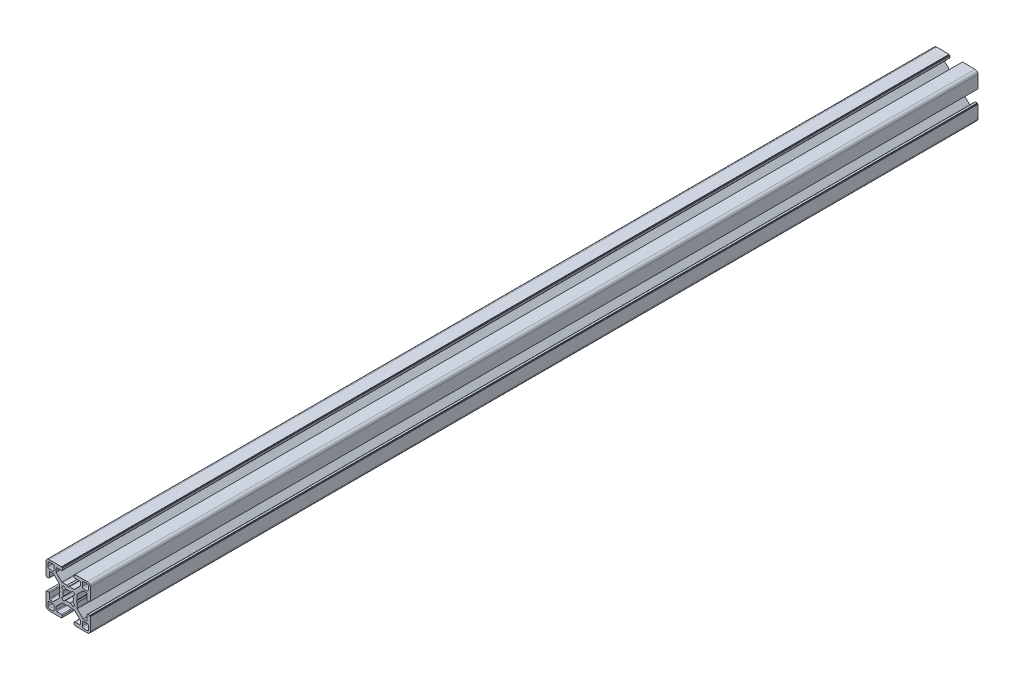
from build123d import *

# Parameters (mm, degrees)
BOSS_EXTRUDE1_DEPTH = 300
CIRPATTERN1_COUNT   = 4


with BuildPart() as part:
    # Sketch3 → Boss-Extrude1 (new, symmetric)
    with BuildSketch(Plane.XY):
        with BuildLine():
            Line((-4.503841895, 3.156803476), (-3.14772708, 1.530298739))
            ThreePointArc((-3.14772708, 1.530298739), (-3.410794979, 0.785160882), (-3.5, 0))
            Line((-3.5, 0), (-5.5, 0))
            Line((-5.5, 0), (-6, 0.866025404))
            Line((-6, 0.866025404), (-6, 3.996841995))
            ThreePointArc((-6, 3.996841995), (-6.038060234, 4.188183711), (-6.146446609, 4.350395385))
            Line((-6.146446609, 4.350395385), (-9.917104615, 8.121053391))
            ThreePointArc((-9.917104615, 8.121053391), (-10.079316289, 8.229439766), (-10.270658005, 8.2675))
            Line((-10.270658005, 8.2675), (-12.29, 8.2675))
            ThreePointArc((-12.29, 8.2675), (-12.643553391, 8.121053391), (-12.79, 7.7675))
            Line((-12.79, 7.7675), (-12.79, 4.5))
            ThreePointArc((-12.79, 4.5), (-12.936446609, 4.146446609), (-13.29, 4))
            Line((-13.29, 4), (-14.5, 4))
            Line((-14.5, 4), (-14.5, 4.5))
            Line((-14.5, 4.5), (-15, 4.5))
            Line((-15, 4.5), (-15, 12.968))
            ThreePointArc((-15, 12.968), (-14.404840979, 14.404840979), (-12.968, 15))
            Line((-12.968, 15), (-4.5, 15))
            Line((-4.5, 15), (-4.5, 14.5))
            Line((-4.5, 14.5), (-4, 14.5))
            Line((-4, 14.5), (-4, 13.29))
            ThreePointArc((-4, 13.29), (-4.146446609, 12.936446609), (-4.5, 12.79))
            Line((-4.5, 12.79), (-7.7675, 12.79))
            ThreePointArc((-7.7675, 12.79), (-8.121053391, 12.643553391), (-8.2675, 12.29))
            Line((-8.2675, 12.29), (-8.2675, 10.270658005))
            ThreePointArc((-8.2675, 10.270658005), (-8.229439766, 10.079316289), (-8.121053391, 9.917104615))
            Line((-8.121053391, 9.917104615), (-4.350395385, 6.146446609))
            ThreePointArc((-4.350395385, 6.146446609), (-4.188183711, 6.038060234), (-3.996841995, 6))
            Line((-3.996841995, 6), (-0.866025404, 6))
            Line((-0.866025404, 6), (0, 5.5))
            Line((0, 5.5), (0, 3.5))
            ThreePointArc((0, 3.5), (-0.785160882, 3.410794979), (-1.530298739, 3.14772708))
            Line((-1.530298739, 3.14772708), (-3.156803476, 4.503841895))
            ThreePointArc((-3.156803476, 4.503841895), (-3.889087297, 3.889087297), (-4.503841895, 3.156803476))
        make_face()
        with BuildLine():
            Line((-12.705, 9.5135), (-10.5135, 9.5135))
            ThreePointArc((-10.5135, 9.5135), (-9.806393219, 9.806393219), (-9.5135, 10.5135))
            Line((-9.5135, 10.5135), (-9.5135, 12.705))
            ThreePointArc((-9.5135, 12.705), (-9.806393219, 13.412106781), (-10.5135, 13.705))
            Line((-10.5135, 13.705), (-12.705, 13.705))
            ThreePointArc((-12.705, 13.705), (-13.412106781, 13.412106781), (-13.705, 12.705))
            Line((-13.705, 12.705), (-13.705, 10.5135))
            ThreePointArc((-13.705, 10.5135), (-13.412106781, 9.806393219), (-12.705, 9.5135))
        make_face(mode=Mode.SUBTRACT)
    boss_extrude1 = extrude(amount=BOSS_EXTRUDE1_DEPTH, both=True)

    # CirPattern1: Boss-Extrude1 ×4 about axis
    cirpattern1_axis = Axis((0, 0, 0), (0, 0, 1))
    for i in range(1, CIRPATTERN1_COUNT):
        add(boss_extrude1.rotate(cirpattern1_axis, i * 360 / CIRPATTERN1_COUNT))


solid = part.part
